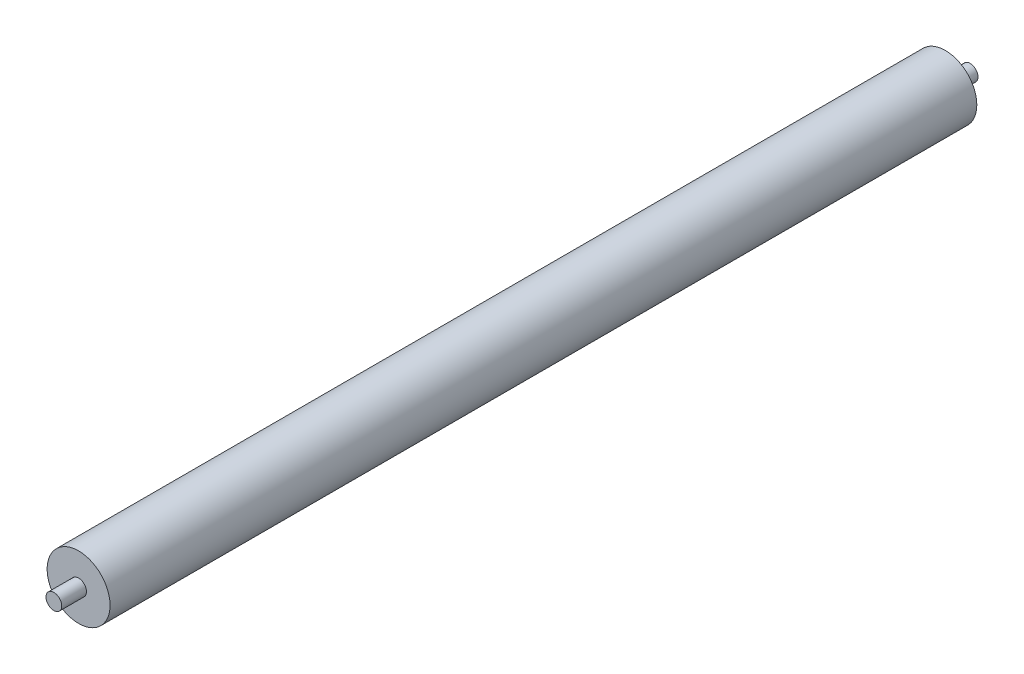
from build123d import *

# Parameters (mm, degrees)
SKETCH1_R           = 25.4
BOSS_EXTRUDE1_DEPTH = 350
SKETCH2_R           = 6.35
BOSS_EXTRUDE2_DEPTH = 370


with BuildPart() as part:
    # Sketch1 → Boss-Extrude1 (new, symmetric)
    with BuildSketch(Plane.XY):
        Circle(SKETCH1_R)
    extrude(amount=BOSS_EXTRUDE1_DEPTH, both=True)

    # Sketch2 → Boss-Extrude2 (add, symmetric)
    with BuildSketch(Plane.XY):
        Circle(SKETCH2_R)
    extrude(amount=BOSS_EXTRUDE2_DEPTH, both=True)


solid = part.part
